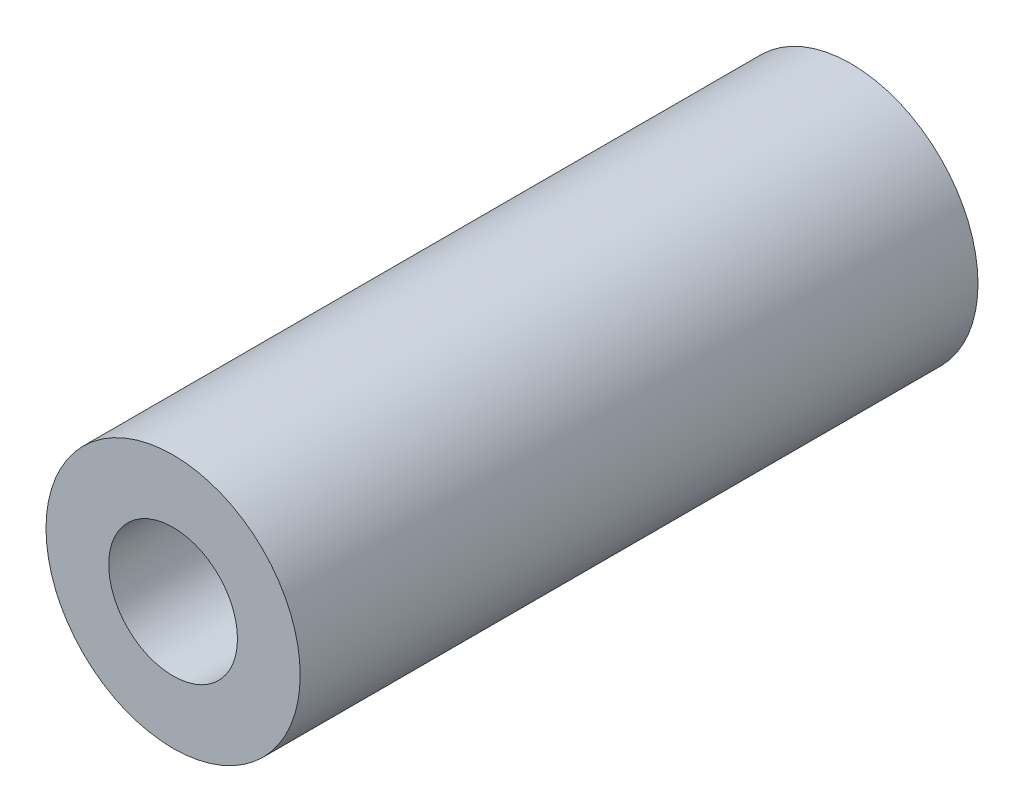
from build123d import *

# Parameters (mm, degrees)
SKETCH1_R           = 9.525
SKETCH1_R_2         = 4.826
BOSS_EXTRUDE1_DEPTH = 50.8


with BuildPart() as part:
    # Sketch1 → Boss-Extrude1 (new body)
    with BuildSketch(Plane.XY):
        Circle(SKETCH1_R)
        Circle(SKETCH1_R_2, mode=Mode.SUBTRACT)
    extrude(amount=BOSS_EXTRUDE1_DEPTH)


solid = part.part
